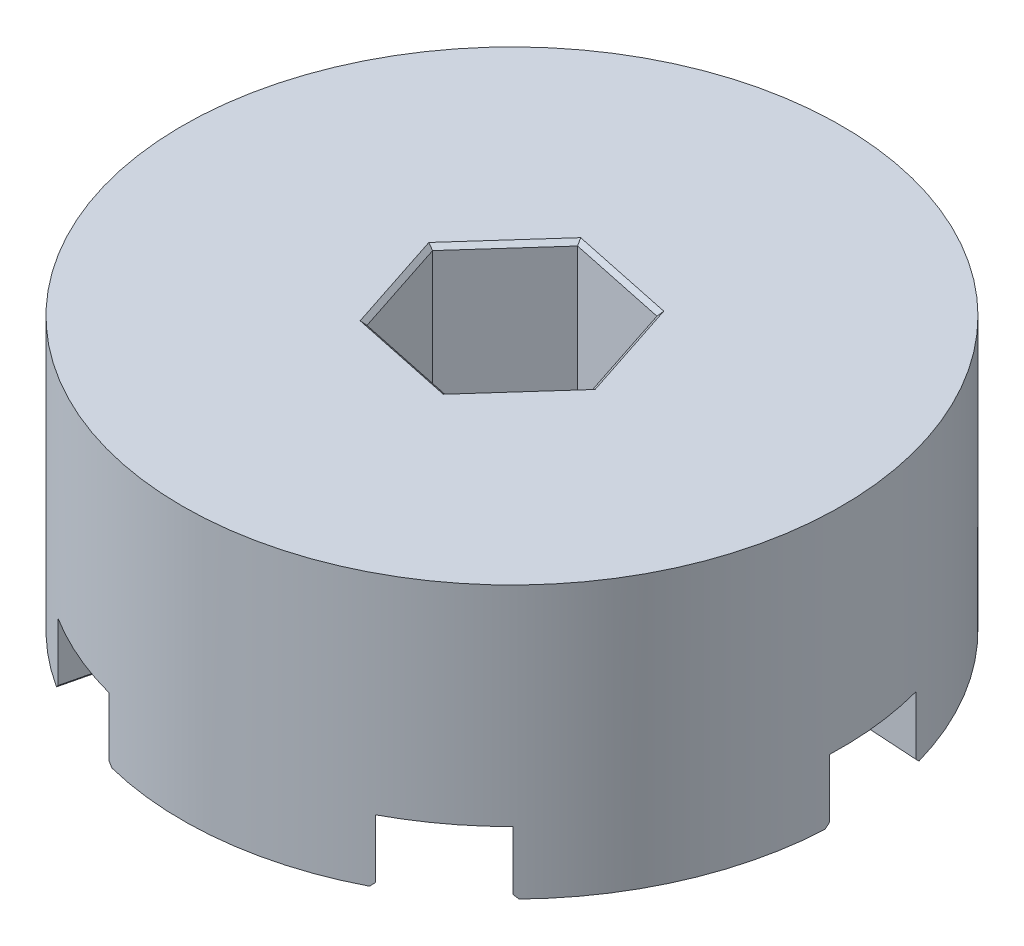
from build123d import *
from build123d.topology import SkipClean

# Parameters (mm, degrees)
SKETCH1_R           = 15.75
BOSS_EXTRUDE1_DEPTH = 10
CUT_EXTRUDE1_DEPTH  = 10
BOSS_EXTRUDE2_START = 3
BOSS_EXTRUDE2_DEPTH = 3
CHAMFER1_SIZE       = 0.2


with BuildPart() as part:
    # Sketch1 → Boss-Extrude1 (new body)
    with BuildSketch(Plane(origin=(0, 0, 0), x_dir=(1, 0, 0), z_dir=(0, 1, 0))):
        with Locations(Location((0, 0, 0), (0, 0, 270))):
            Circle(SKETCH1_R)
    extrude(amount=BOSS_EXTRUDE1_DEPTH)

    # Sketch2 → Cut-Extrude1 (cut)
    with BuildSketch(Plane(origin=(0, 10, 0), x_dir=(1, 0, 0), z_dir=(0, 1, 0))):
        Polygon((3.274663124, 3.655121716), (-1.528096697, 4.663502312), (-4.802759822, 1.008380597), (-3.274663124, -3.655121716), (1.528096697, -4.663502312), (4.802759822, -1.008380597), align=None)
    extrude(amount=-CUT_EXTRUDE1_DEPTH, mode=Mode.SUBTRACT)

    # Sketch3 → Boss-Extrude2 (add)
    with SkipClean():  # the faces are left unmerged after this step: merging them gives an invalid solid
        with BuildSketch(Plane.XZ.offset(BOSS_EXTRUDE2_START)):
            with BuildLine():
                Line((-11.155612536, -11.118219684), (-7.154915715, -3.105991164))
                Line((-7.154915715, -3.105991164), (-15.740134193, -0.557382799))
                ThreePointArc((-15.740134193, -0.557382799), (-14.447425963, -6.271712927), (-11.155612536, -11.118219684))
            make_face()
            with BuildLine():
                Line((-0.887590606, -7.749334353), (-7.387359433, -13.910047469))
                ThreePointArc((-7.387359433, -13.910047469), (-1.792250262, -15.647694367), (4.050854423, -15.220153693))
                Line((4.050854423, -15.220153693), (-0.887590606, -7.749334353))
            make_face()
            with BuildLine():
                Line((6.267325109, -4.643343189), (8.35277476, -13.352664671))
                ThreePointArc((8.35277476, -13.352664671), (12.655175702, -9.37598144), (15.206466959, -4.101934009))
                Line((15.206466959, -4.101934009), (6.267325109, -4.643343189))
            make_face()
            with BuildLine():
                ThreePointArc((15.740134193, 0.557382799), (14.447425963, 6.271712927), (11.155612536, 11.118219684))
                Line((11.155612536, 11.118219684), (7.154915715, 3.105991164))
                Line((7.154915715, 3.105991164), (15.740134193, 0.557382799))
            make_face()
            with BuildLine():
                ThreePointArc((7.387359433, 13.910047469), (1.792250262, 15.647694367), (-4.050854423, 15.220153693))
                Line((-4.050854423, 15.220153693), (0.887590606, 7.749334353))
                Line((0.887590606, 7.749334353), (7.387359433, 13.910047469))
            make_face()
            with BuildLine():
                ThreePointArc((-8.35277476, 13.352664671), (-12.655175702, 9.37598144), (-15.206466959, 4.101934009))
                Line((-15.206466959, 4.101934009), (-6.267325109, 4.643343189))
                Line((-6.267325109, 4.643343189), (-8.35277476, 13.352664671))
            make_face()
        extrude(amount=-BOSS_EXTRUDE2_DEPTH)

    # Chamfer1
    chamfer1_edges = [part.edges().sort_by_distance(p)[0] for p in [
        (4.038711473, 10, -1.323370559),
        (0.873283214, 10, -4.159312014),
        (-3.16542826, 10, -2.835941455),
        (-4.038711473, 10, 1.323370559),
        (-0.873283214, 10, 4.159312014),
        (3.16542826, 10, 2.835941455),
        (-9.155264126, -3, -7.112105424),
        (-11.447524954, -3, -1.831686981),
        (1.581631909, -3, -11.484744023),
        (-4.13747502, -3, -10.829690911),
        (10.736896034, -3, -4.372638599),
        (7.310049935, -3, -8.99800393),
        (9.155264126, -3, 7.112105424),
        (11.447524954, -3, 1.831686981),
        (-1.581631909, -3, 11.484744023),
        (4.13747502, -3, 10.829690911),
        (-10.736896034, -3, 4.372638599),
        (-7.310049935, -3, 8.99800393),
    ]]
    chamfer(chamfer1_edges, length=CHAMFER1_SIZE)


solid = part.part
